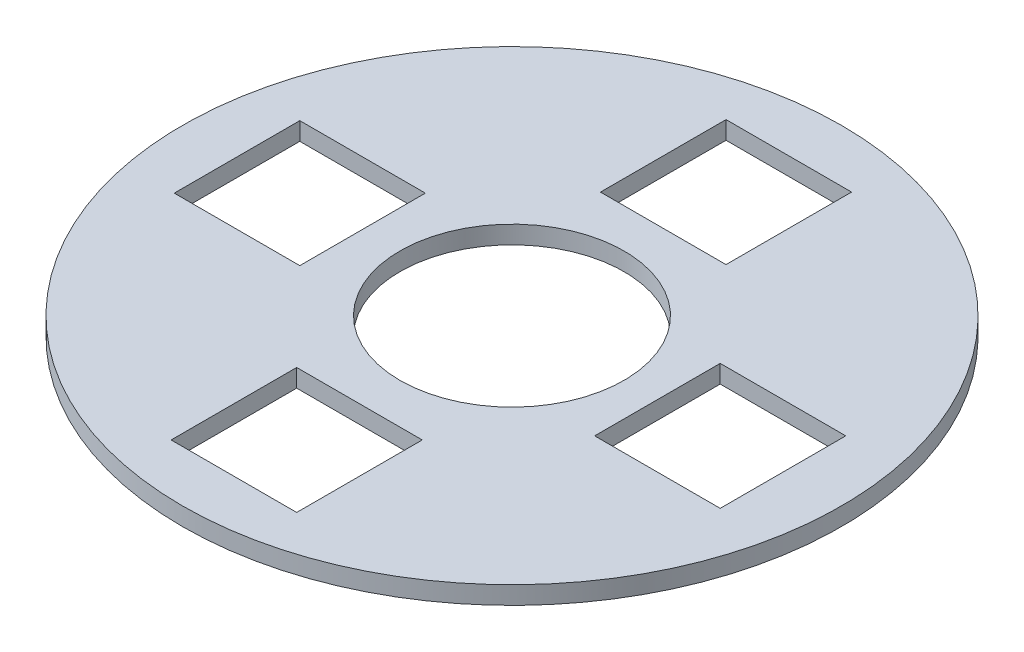
from build123d import *

# Parameters (mm, degrees)
SKETCH3_R           = 36.75
BOSS_EXTRUDE1_DEPTH = 2
SKETCH4_R           = 12.5
CUT_EXTRUDE1_DEPTH  = 53.010816183
CUT_EXTRUDE2_DEPTH  = 53.010816183
SKETCH6_W           = 14
SKETCH6_H           = 14
CUT_EXTRUDE3_DEPTH  = 53.010816183
CUT_EXTRUDE4_DEPTH  = 53.010816183


with BuildPart() as part:
    # Sketch3 → Boss-Extrude1 (new body)
    with BuildSketch(Plane(origin=(0, 0, 0), x_dir=(1, 0, 0), z_dir=(0, 1, 0))):
        with Locations(Location((0, 0, 0), (0, 0, 270))):
            Circle(SKETCH3_R)
    extrude(amount=BOSS_EXTRUDE1_DEPTH)

    # Sketch4 → Cut-Extrude1 (cut, through all)
    with BuildSketch(Plane(origin=(0, 0, 0), x_dir=(1, 0, 0), z_dir=(0, 1, 0))):
        with Locations(Location((0, 0, 0), (0, 0, 270))):
            Circle(SKETCH4_R)
    extrude(amount=CUT_EXTRUDE1_DEPTH, mode=Mode.SUBTRACT)

    # Sketch5 → Cut-Extrude2 (cut, through all)
    with BuildSketch(Plane(origin=(0, 2, 0), x_dir=(1, 0, 0), z_dir=(0, 1, 0))):
        Polygon((-30.663619776, 7), (-30.663619776, 0), (-30.663619776, -7), (-16.663619776, -7), (-16.663619776, 7), align=None)
    extrude(amount=-CUT_EXTRUDE2_DEPTH, mode=Mode.SUBTRACT)

    # Sketch6 → Cut-Extrude3 (cut, through all)
    with BuildSketch(Plane(origin=(0, 2, 0), x_dir=(1, 0, 0), z_dir=(0, 1, 0))):
        with Locations((23.218077959, 0)):
            Rectangle(SKETCH6_W, SKETCH6_H)
    extrude(amount=-CUT_EXTRUDE3_DEPTH, mode=Mode.SUBTRACT)

    # Sketch8 → Cut-Extrude4 (cut, through all)
    with BuildSketch(Plane(origin=(0, 0, 0), x_dir=(1, 0, 0), z_dir=(0, 1, 0))):
        Polygon((0, 30.868072457), (-7, 30.868072457), (-7, 16.864385373), (6.999997959, 16.864385373), (6.999997959, 30.868072457), align=None)
        Polygon((0, -31.010274177), (7, -31.010274177), (7, -17.010274177), (-7, -17.010274177), (-7, -31.010274177), align=None)
    extrude(amount=CUT_EXTRUDE4_DEPTH, mode=Mode.SUBTRACT)


solid = part.part
